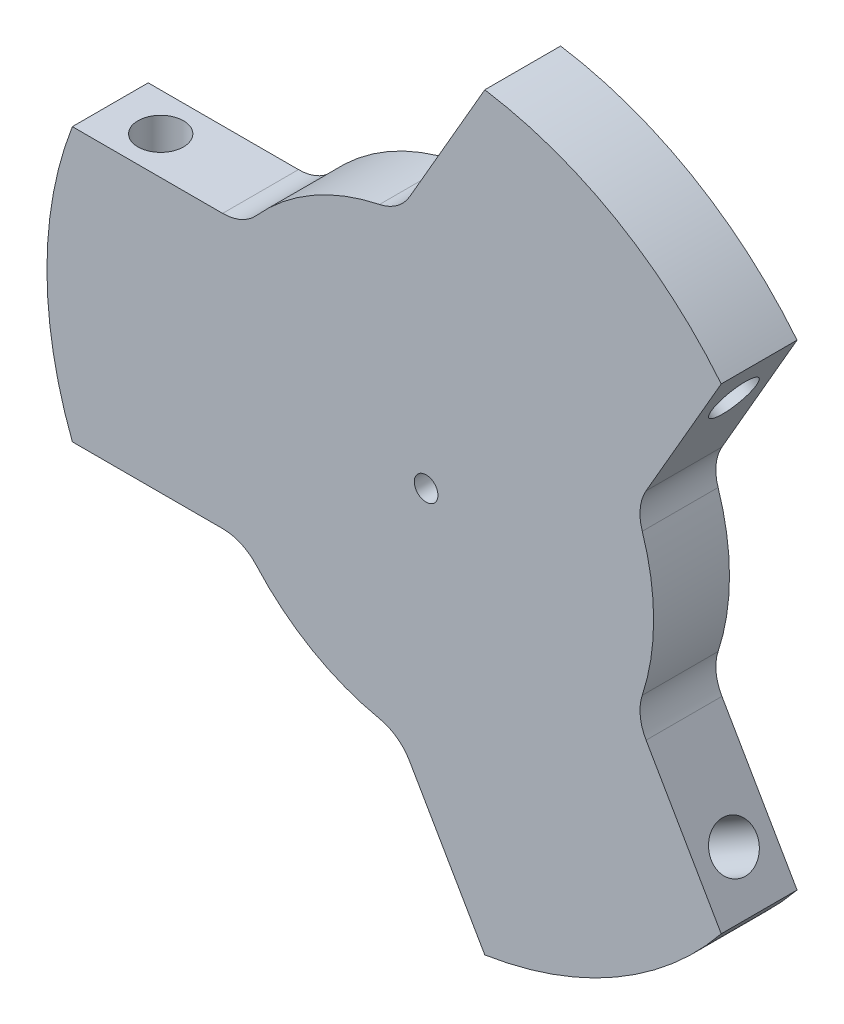
from build123d import *

# Parameters (mm, degrees)
SKIZZE1_R                       = 25
AUFSATZ_LINEAR_AUSTRAGEN1_DEPTH = 5
SCHNITT_LINEAR_AUSTRAGEN1_DEPTH = 36.707142143
SKIZZE3_R                       = 1.5
SCHNITT_LINEAR_AUSTRAGEN2_DEPTH = 43.256635771
KREISMUSTER1_COUNT              = 3
SKIZZE6_R                       = 0.78
SCHNITT_LINEAR_AUSTRAGEN5_DEPTH = 36.497057468
VERRUNDUNG1_R                   = 3


with BuildPart() as part:
    # Skizze1 → Aufsatz-Linear austragen1 (new body)
    with BuildSketch(Plane.XY):
        Circle(SKIZZE1_R)
    extrude(amount=AUFSATZ_LINEAR_AUSTRAGEN1_DEPTH)

    # Skizze2 → Schnitt-Linear austragen1 (cut, through all)
    with BuildSketch(Plane.XY.offset(5)):
        with BuildLine():
            Line((19.456132424, 15.699009877), (13.794228634, 5.892304845))
            ThreePointArc((13.794228634, 5.892304845), (15, 0), (13.794228634, -5.892304845))
            Line((13.794228634, -5.892304845), (19.456132424, -15.699009877))
            ThreePointArc((19.456132424, -15.699009877), (25, 0), (19.456132424, 15.699009877))
        make_face()
        with BuildLine():
            Line((-23.323807579, 9), (-12, 9))
            ThreePointArc((-12, 9), (-7.5, 12.990381057), (-1.794228634, 14.892304845))
            Line((-1.794228634, 14.892304845), (3.867675156, 24.699009877))
            ThreePointArc((3.867675156, 24.699009877), (-12.5, 21.650635095), (-23.323807579, 9))
        make_face()
        with BuildLine():
            Line((3.867675156, -24.699009877), (-1.794228634, -14.892304845))
            ThreePointArc((-1.794228634, -14.892304845), (-7.5, -12.990381057), (-12, -9))
            Line((-12, -9), (-23.323807579, -9))
            ThreePointArc((-23.323807579, -9), (-12.5, -21.650635095), (3.867675156, -24.699009877))
        make_face()
    extrude(amount=-SCHNITT_LINEAR_AUSTRAGEN1_DEPTH, mode=Mode.SUBTRACT)

    # Skizze3 → Schnitt-Linear austragen2 (cut, through all)
    with BuildSketch(Plane(origin=(0, 9, 0), x_dir=(1, 0, 0), z_dir=(0, 1, 0))):
        with Locations(Location((-20, -2.5, 0), (0, 0, 270))):
            Circle(SKIZZE3_R)
    schnitt_linear_austragen2 = extrude(amount=-SCHNITT_LINEAR_AUSTRAGEN2_DEPTH, mode=Mode.SUBTRACT)

    # Kreismuster1: Schnitt-Linear austragen2 ×3 about axis
    kreismuster1_axis = Axis((0, 0, 5), (0, 0, -1))
    for i in range(1, KREISMUSTER1_COUNT):
        add(schnitt_linear_austragen2.rotate(kreismuster1_axis, i * 360 / KREISMUSTER1_COUNT), mode=Mode.SUBTRACT)

    # Skizze6 → Schnitt-Linear austragen5 (cut, through all)
    with BuildSketch(Plane.XY.offset(5)):
        Circle(SKIZZE6_R)
    extrude(amount=-SCHNITT_LINEAR_AUSTRAGEN5_DEPTH, mode=Mode.SUBTRACT)

    # Verrundung1
    verrundung1_edges = [part.edges().sort_by_distance(p)[0] for p in [
        (-1.794228634, 14.892304845, 2.5),
        (-12, 9, 2.5),
        (-12, -9, 2.5),
        (-1.794228634, -14.892304845, 2.5),
        (13.794228634, -5.892304845, 2.5),
        (13.794228634, 5.892304845, 2.5),
    ]]
    fillet(verrundung1_edges, radius=VERRUNDUNG1_R)


solid = part.part
